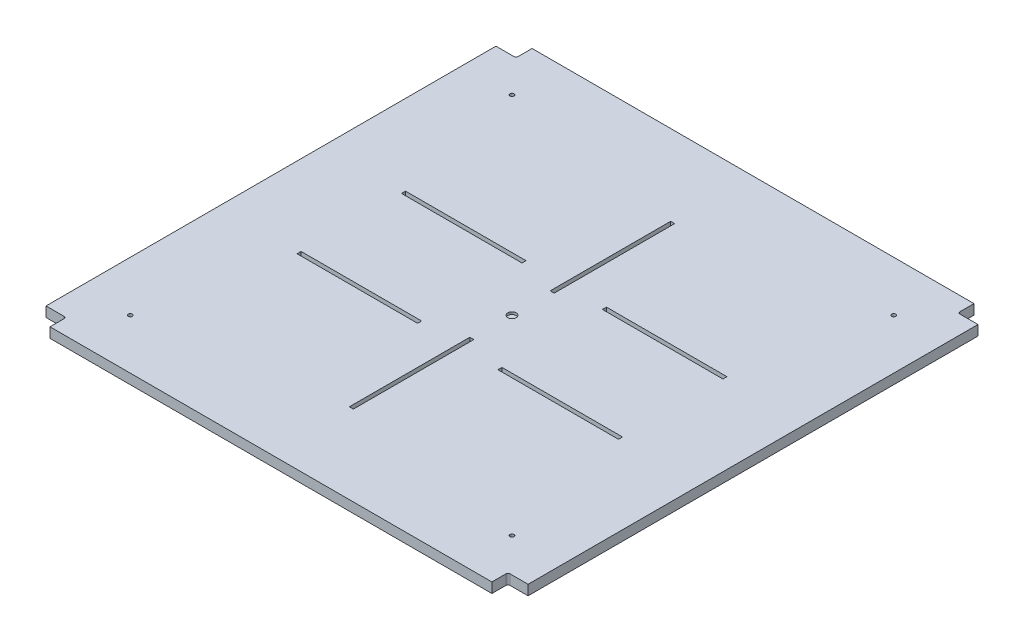
from build123d import *

# Parameters (mm, degrees)
EXTRUDE_1_DEPTH     = 25
FILLET_1_R          = 10
SKETCH_2_R          = 10
CUT_EXTRUDE_1_DEPTH = 1698.792684635
SKETCH_3_R          = 21
CUT_EXTRUDE_2_DEPTH = 12
SKETCH_4_W          = 20
SKETCH_4_H          = 600
SKETCH_4_W_2        = 600
SKETCH_4_H_2        = 20
CUT_EXTRUDE_3_DEPTH = 1698.792684635


with BuildPart() as part:
    # Эскиз1 → Бобышка-Вытянуть1 (new, symmetric)
    with BuildSketch(Plane(origin=(0, 0, 0), x_dir=(1, 0, 0), z_dir=(0, 1, 0))):
        Polygon((-1100, 1120), (-1200, 1120), (-1200, -1120), (-1100, -1120), (-1100, -1200), (1100, -1200), (1100, -1120), (1200, -1120), (1200, 1120), (1100, 1120), (1100, 1200), (-1100, 1200), align=None)
    extrude(amount=EXTRUDE_1_DEPTH, both=True)

    # Скругление1
    fillet_1_edges = [part.edges().sort_by_distance(p)[0] for p in [
        (-1100, 0, -1120),
        (1100, 0, -1120),
        (1100, 0, 1120),
        (-1100, 0, 1120),
    ]]
    fillet(fillet_1_edges, radius=FILLET_1_R)

    # Эскиз2 → Вырез-Вытянуть1 (cut, through all)
    with BuildSketch(Plane(origin=(0, 25, 0), x_dir=(1, 0, 0), z_dir=(0, 1, 0))):
        with Locations(Location((-950, 950, 0), (0, 0, 270))):
            Circle(SKETCH_2_R)
        with Locations(Location((950, 950, 0), (0, 0, 270))):
            Circle(SKETCH_2_R)
        with Locations(Location((950, -950, 0), (0, 0, 270))):
            Circle(SKETCH_2_R)
        with Locations(Location((-950, -950, 0), (0, 0, 270))):
            Circle(SKETCH_2_R)
    extrude(amount=-CUT_EXTRUDE_1_DEPTH, mode=Mode.SUBTRACT)

    # Эскиз3 → Вырез-Вытянуть2 (cut)
    with BuildSketch(Plane(origin=(0, 25, 0), x_dir=(1, 0, 0), z_dir=(0, 1, 0))):
        with Locations(Location((0, 0, 0), (0, 0, 270))):
            Circle(SKETCH_3_R)
    extrude(amount=-CUT_EXTRUDE_2_DEPTH, mode=Mode.SUBTRACT)

    # Эскиз4 → Вырез-Вытянуть3 (cut, through all)
    with BuildSketch(Plane(origin=(0, 25, 0), x_dir=(1, 0, 0), z_dir=(0, 1, 0))):
        with Locations((0, -500)):
            Rectangle(SKETCH_4_W, SKETCH_4_H)
        with Locations((0, 500)):
            Rectangle(SKETCH_4_W, SKETCH_4_H)
        with Locations((500, -260)):
            Rectangle(SKETCH_4_W_2, SKETCH_4_H_2)
        with Locations((500, 260)):
            Rectangle(SKETCH_4_W_2, SKETCH_4_H_2)
        with Locations((-500, -260)):
            Rectangle(SKETCH_4_W_2, SKETCH_4_H_2)
        with Locations((-500, 260)):
            Rectangle(SKETCH_4_W_2, SKETCH_4_H_2)
    extrude(amount=-CUT_EXTRUDE_3_DEPTH, mode=Mode.SUBTRACT)


solid = part.part
